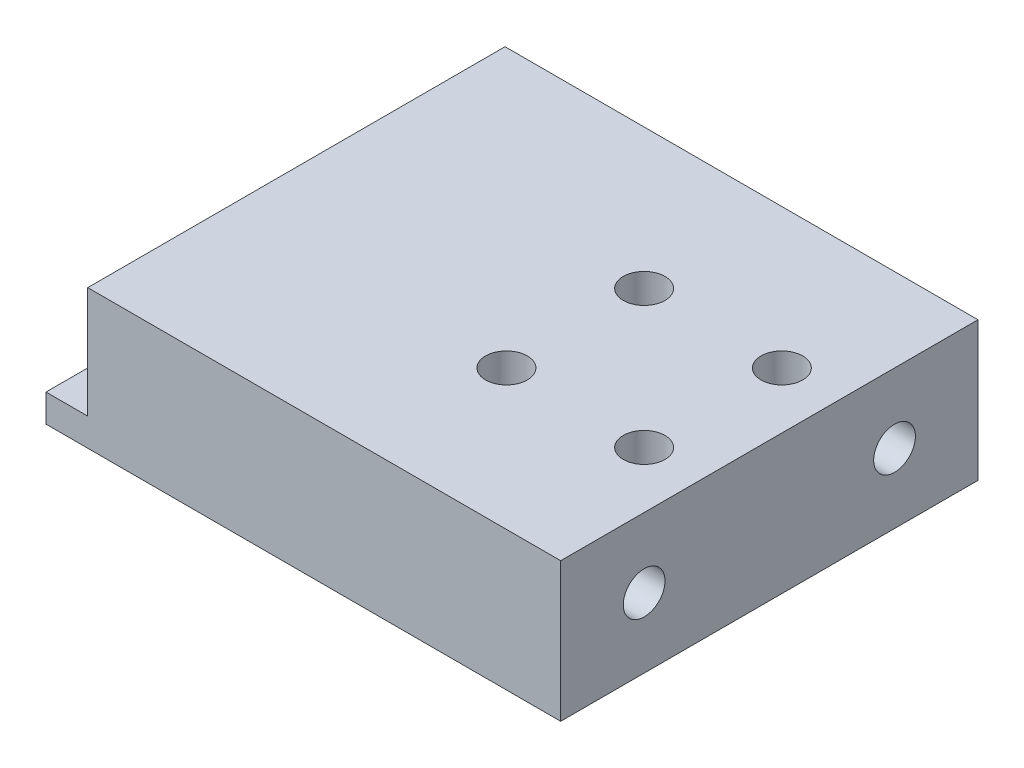
from build123d import *

# Parameters (mm, degrees)
SKETCH_1_W          = 37
SKETCH_1_H          = 30
SKETCH_1_R          = 1.5
EXTRUDE_1_DEPTH     = 10
SKETCH_2_R          = 1.5
CUT_EXTRUDE_1_DEPTH = 6
SKETCH_3_W          = 30
SKETCH_3_H          = 8
CUT_EXTRUDE_2_DEPTH = 3
SKETCH_4_R          = 1
CUT_EXTRUDE_3_DEPTH = 7


with BuildPart() as part:
    # Эскиз1 → Бобышка-Вытянуть1 (new body)
    with BuildSketch(Plane(origin=(0, 0, 0), x_dir=(1, 0, 0), z_dir=(0, 1, 0))):
        with Locations((18.5, 15)):
            Rectangle(SKETCH_1_W, SKETCH_1_H)
        with Locations(Location((32.949747468, 19.949747468, 0), (0, 0, 270))):
            Circle(SKETCH_1_R, mode=Mode.SUBTRACT)
        with Locations(Location((23.050252532, 19.949747468, 0), (0, 0, 270))):
            Circle(SKETCH_1_R, mode=Mode.SUBTRACT)
        with Locations(Location((32.949747468, 10.050252532, 0), (0, 0, 270))):
            Circle(SKETCH_1_R, mode=Mode.SUBTRACT)
        with Locations(Location((23.050252532, 10.050252532, 0), (0, 0, 270))):
            Circle(SKETCH_1_R, mode=Mode.SUBTRACT)
    extrude(amount=EXTRUDE_1_DEPTH)

    # Эскиз2 → Вырез-Вытянуть1 (cut)
    with BuildSketch(Plane(origin=(37, 0, 0), x_dir=(0, 0, -1), z_dir=(1, 0, 0))):
        with Locations((6, 5)):
            Circle(SKETCH_2_R)
        with Locations((24, 5)):
            Circle(SKETCH_2_R)
    extrude(amount=-CUT_EXTRUDE_1_DEPTH, mode=Mode.SUBTRACT)

    # Эскиз3 → Вырез-Вытянуть2 (cut)
    with BuildSketch(Plane.ZY):
        with Locations((-15, 6)):
            Rectangle(SKETCH_3_W, SKETCH_3_H)
    extrude(amount=-CUT_EXTRUDE_2_DEPTH, mode=Mode.SUBTRACT)

    # Эскиз4 → Вырез-Вытянуть3 (cut)
    with BuildSketch(Plane.ZY):
        with Locations((-20, 5.4)):
            Circle(SKETCH_4_R)
        with Locations((-10, 5.4)):
            Circle(SKETCH_4_R)
    extrude(amount=-CUT_EXTRUDE_3_DEPTH, mode=Mode.SUBTRACT)


solid = part.part
